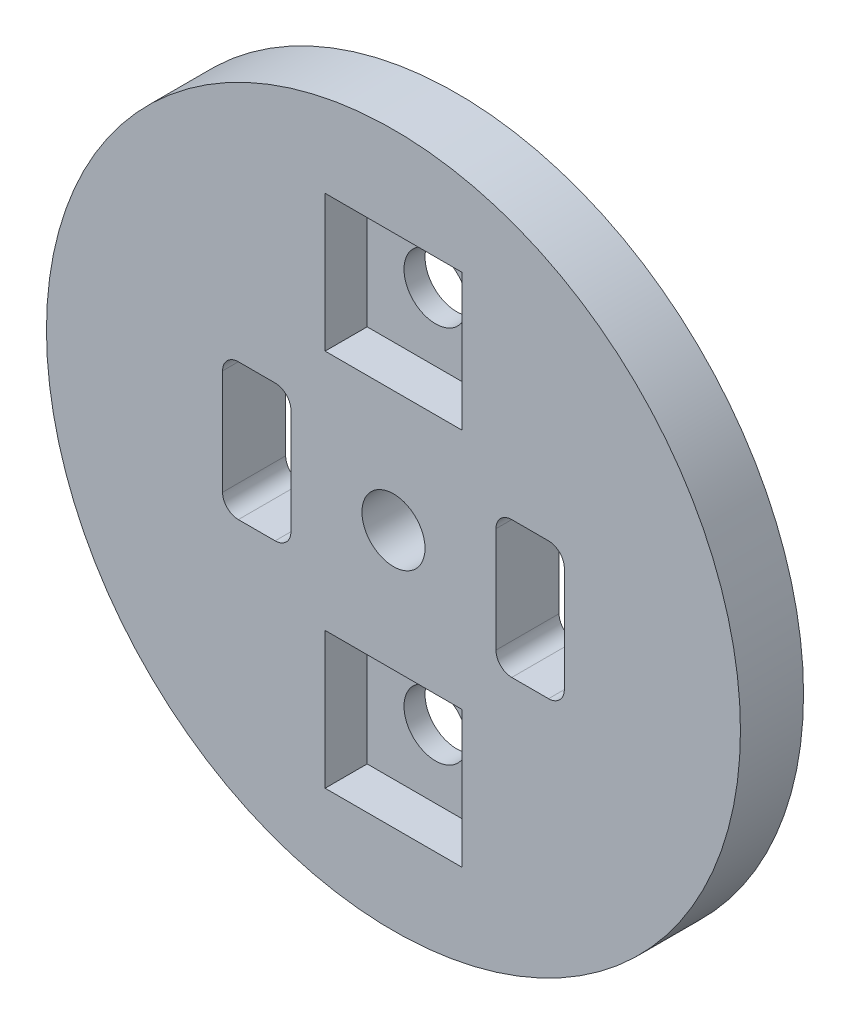
from build123d import *

# Parameters (mm, degrees)
MODEL_R                 = 16.5
MODEL_R_2               = 1.5
SALIENTE_EXTRUIR1_DEPTH = 3
CROQUIS2_W              = 6.5
CROQUIS2_H              = 6.5
CROQUIS2_W_2            = 6.500000001
CORTAR_EXTRUIR1_DEPTH   = 2


with BuildPart() as part:
    # Model → Saliente-Extruir1 (new body)
    with BuildSketch(Plane.XY):
        with Locations((215.747807914, 241.952019993)):
            Circle(MODEL_R)
        with Locations((215.747807914, 232.952019993)):
            Circle(MODEL_R_2, mode=Mode.SUBTRACT)
        with Locations((215.747807914, 241.952019993)):
            Circle(MODEL_R_2, mode=Mode.SUBTRACT)
        with BuildLine():
            ThreePointArc((207.622807913, 244.452019993), (207.842477828, 244.982350079), (208.372807913, 245.202019993))
            Line((208.372807913, 245.202019993), (210.122807913, 245.202019993))
            ThreePointArc((210.122807913, 245.202019993), (210.653137999, 244.982350079), (210.872807913, 244.452019993))
            Line((210.872807913, 244.452019993), (210.872807913, 239.452019993))
            ThreePointArc((210.872807914, 239.452019993), (210.653137999, 238.921689907), (210.122807913, 238.702019993))
            Line((210.122807913, 238.702019993), (208.372807913, 238.702019993))
            ThreePointArc((208.372807913, 238.702019993), (207.842477828, 238.921689907), (207.622807913, 239.452019993))
            Line((207.622807913, 239.452019993), (207.622807913, 244.452019993))
        make_face(mode=Mode.SUBTRACT)
        with BuildLine():
            Line((221.372807913, 245.202019993), (223.122807913, 245.202019993))
            ThreePointArc((223.122807913, 245.202019993), (223.653137999, 244.982350079), (223.872807913, 244.452019993))
            Line((223.872807913, 244.452019993), (223.872807913, 239.452019993))
            ThreePointArc((223.872807914, 239.452019993), (223.653137999, 238.921689907), (223.122807913, 238.702019993))
            Line((223.122807913, 238.702019993), (221.372807913, 238.702019993))
            ThreePointArc((221.372807913, 238.702019993), (220.842477828, 238.921689907), (220.622807913, 239.452019993))
            Line((220.622807913, 239.452019993), (220.622807913, 244.452019993))
            ThreePointArc((220.622807913, 244.452019993), (220.842477828, 244.982350079), (221.372807913, 245.202019993))
        make_face(mode=Mode.SUBTRACT)
        with Locations((215.747807914, 250.952019993)):
            Circle(MODEL_R_2, mode=Mode.SUBTRACT)
    extrude(amount=SALIENTE_EXTRUIR1_DEPTH)

    # Croquis2 → Cortar-Extruir1 (cut)
    with BuildSketch(Plane.XY.offset(3)):
        with Locations((215.747807914, 250.952019993)):
            Rectangle(CROQUIS2_W, CROQUIS2_H)
        with Locations((215.747807914, 232.952019993)):
            Rectangle(CROQUIS2_W_2, CROQUIS2_H)
    extrude(amount=-CORTAR_EXTRUIR1_DEPTH, mode=Mode.SUBTRACT)


solid = part.part
